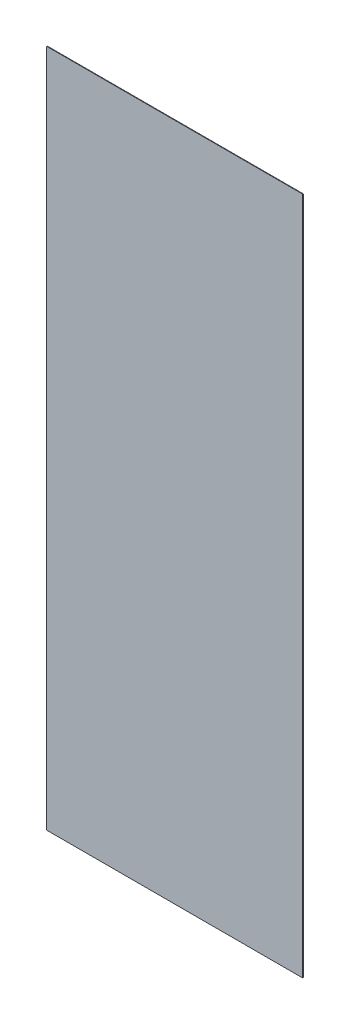
from build123d import *

# Parameters (mm, degrees)
PACK_DIS_ARKA_1_START = -818.5
SKETCH1_W             = 697
SKETCH1_H             = 1848.5
PACK_DIS_ARKA_1_DEPTH = 1.5


with BuildPart() as part:
    # Sketch1 → PACK_dis_arka_1 (new body)
    with BuildSketch(Plane.XY.offset(PACK_DIS_ARKA_1_START)):
        with Locations((350, 1044.25)):
            Rectangle(SKETCH1_W, SKETCH1_H)
    extrude(amount=-PACK_DIS_ARKA_1_DEPTH)


solid = part.part
